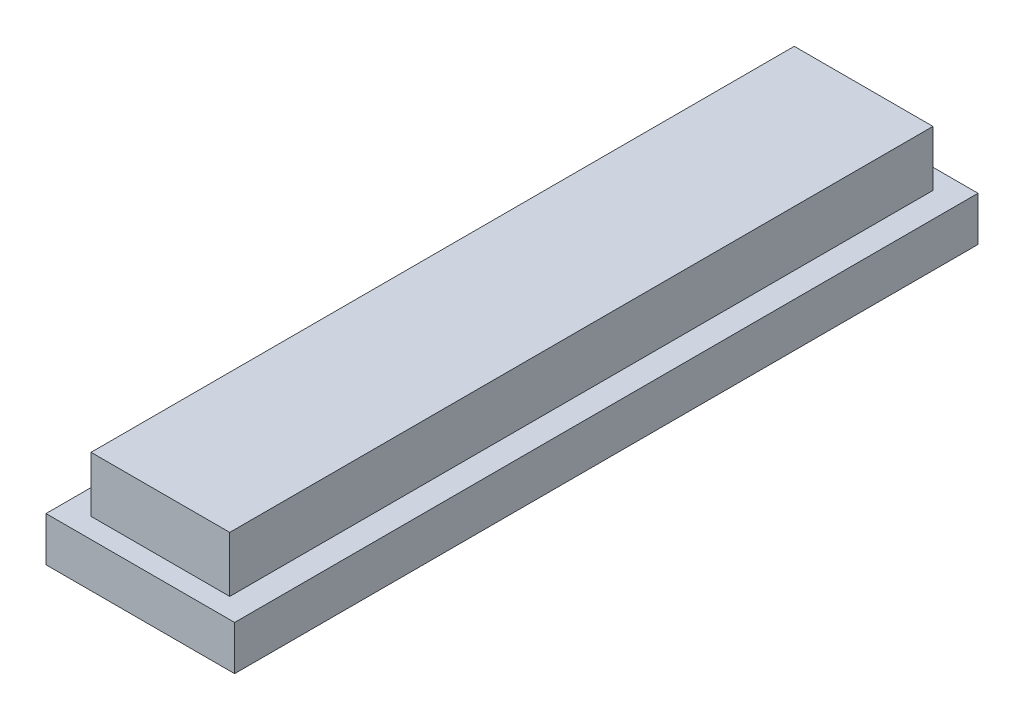
from build123d import *

# Parameters (mm, degrees)
SKETCH1_W           = 17
SKETCH1_H           = 67
BOSS_EXTRUDE1_DEPTH = 4
SKETCH2_W           = 12.5
SKETCH2_H           = 63.38
BOSS_EXTRUDE2_DEPTH = 5
SKETCH3_R           = 3.45
CUT_EXTRUDE1_DEPTH  = 1
SKETCH4_R           = 2.95
CUT_EXTRUDE2_DEPTH  = 7.5


with BuildPart() as part:
    # Sketch1 → Boss-Extrude1 (new body)
    with BuildSketch(Plane(origin=(0, 0, 0), x_dir=(1, 0, 0), z_dir=(0, 1, 0))):
        Rectangle(SKETCH1_W, SKETCH1_H)
    extrude(amount=BOSS_EXTRUDE1_DEPTH)

    # Sketch2 → Boss-Extrude2 (add)
    with BuildSketch(Plane(origin=(0, 4, 0), x_dir=(1, 0, 0), z_dir=(0, 1, 0))):
        Rectangle(SKETCH2_W, SKETCH2_H)
    extrude(amount=BOSS_EXTRUDE2_DEPTH)

    # Sketch3 → Cut-Extrude1 (cut)
    with BuildSketch(Plane.XZ):
        with Locations(Location((0, 0, 0), (0, 0, 270))):
            Circle(SKETCH3_R)
        with Locations(Location((0.136814879, 12.999280045, 0), (0, 0, 270))):
            Circle(SKETCH3_R)
        with Locations(Location((0.273629759, 25.99856009, 0), (0, 0, 270))):
            Circle(SKETCH3_R)
        with Locations(Location((0.000272251, -12.999999997, 0), (0, 0, 270))):
            Circle(SKETCH3_R)
        with Locations(Location((0.000544502, -25.999999994, 0), (0, 0, 270))):
            Circle(SKETCH3_R)
    extrude(amount=-CUT_EXTRUDE1_DEPTH, mode=Mode.SUBTRACT)

    # Sketch4 → Cut-Extrude2 (cut)
    with BuildSketch(Plane.XZ):
        with Locations(Location((0, 0, 0), (0, 0, 270))):
            Circle(SKETCH4_R)
        with Locations(Location((0.136814879, 12.999280045, 0), (0, 0, 270))):
            Circle(SKETCH4_R)
        with Locations(Location((0.273629759, 25.99856009, 0), (0, 0, 270))):
            Circle(SKETCH4_R)
        with Locations(Location((0.000272251, -12.999999997, 0), (0, 0, 270))):
            Circle(SKETCH4_R)
        with Locations(Location((0.000544502, -25.999999994, 0), (0, 0, 270))):
            Circle(SKETCH4_R)
    extrude(amount=-CUT_EXTRUDE2_DEPTH, mode=Mode.SUBTRACT)


solid = part.part
